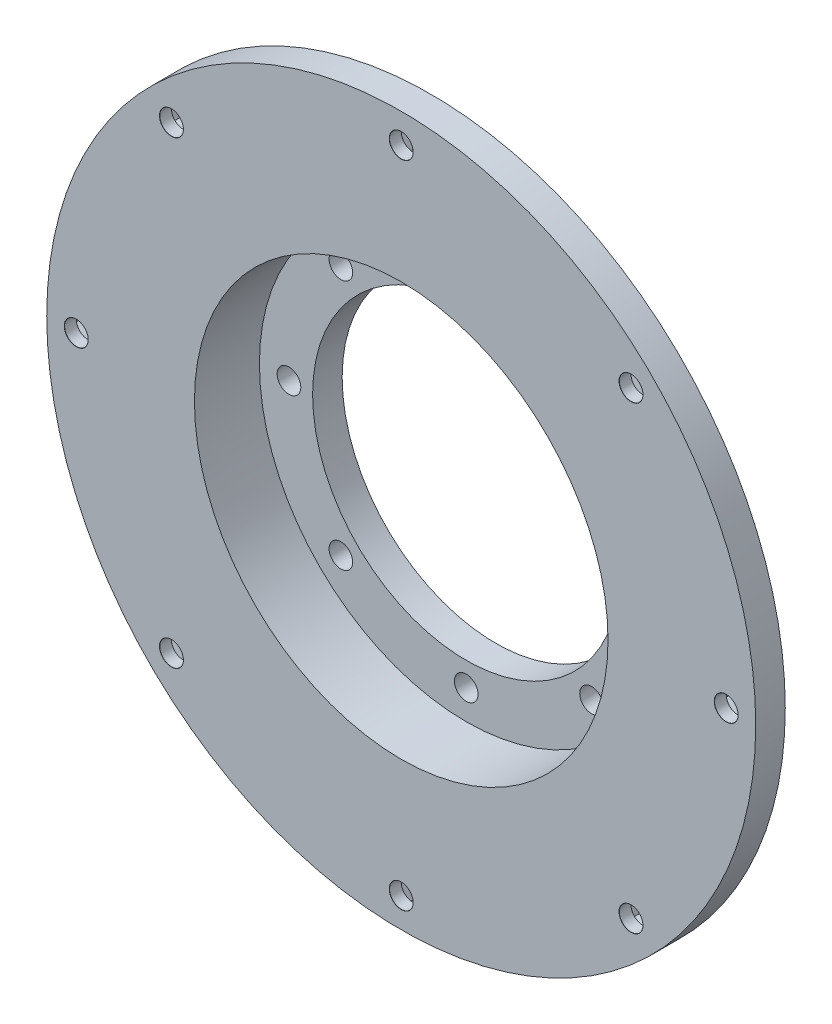
from build123d import *

# Parameters (mm, degrees)
SKETCH1_R                       = 35
SKETCH1_R_2                     = 26
BOSS_EXTRUDE1_DEPTH             = 5
F_4_0MM_DOWEL_HOLE1_D           = 4
F_4_0MM_DOWEL_HOLE1_CSINK_D     = 4.05
F_4_0MM_DOWEL_HOLE1_CSINK_ANGLE = 90
SKETCH5_R                       = 40
SKETCH5_R_2                     = 35
BOSS_EXTRUDE2_DEPTH             = 16
BOSS_EXTRUDE3_START             = -5
SKETCH6_R                       = 60
SKETCH6_R_2                     = 35
BOSS_EXTRUDE3_DEPTH             = 5
F_4_0MM_DOWEL_HOLE2_D           = 4
F_4_0MM_DOWEL_HOLE2_CSINK_D     = 4.05
F_4_0MM_DOWEL_HOLE2_CSINK_ANGLE = 90
CUT_EXTRUDE3_DEPTH              = 3


with BuildPart() as part:
    # Sketch1 → Boss-Extrude1 (new body)
    with BuildSketch(Plane.XY):
        Circle(SKETCH1_R)
        Circle(SKETCH1_R_2, mode=Mode.SUBTRACT)
    extrude(amount=BOSS_EXTRUDE1_DEPTH)

    # Ø4.0mm Dowel Hole1 (through all)
    with Locations(Plane(origin=(0, 0, 0), x_dir=(-1, 0, 0), z_dir=(0, 0, -1))):
        with Locations((21.213203436, 21.213203436), (0, 30), (-21.213203436, 21.213203436), (-30, 0), (-21.213203436, -21.213203436), (0, -30), (21.213203436, -21.213203436), (30, 0)):
            CounterSinkHole(F_4_0MM_DOWEL_HOLE1_D / 2, F_4_0MM_DOWEL_HOLE1_CSINK_D / 2, counter_sink_angle=F_4_0MM_DOWEL_HOLE1_CSINK_ANGLE)

    # Sketch5 → Boss-Extrude2 (add)
    with BuildSketch(Plane(origin=(0, 0, 0), x_dir=(-1, 0, 0), z_dir=(0, 0, -1))):
        Circle(SKETCH5_R)
        Circle(SKETCH5_R_2, mode=Mode.SUBTRACT)
    extrude(amount=-BOSS_EXTRUDE2_DEPTH)

    # Sketch6 → Boss-Extrude3 (add)
    with BuildSketch(Plane.XY.offset(16).offset(BOSS_EXTRUDE3_START)):
        Circle(SKETCH6_R)
        with Locations(Location((0, 0, 0), (0, 0, 180))):
            Circle(SKETCH6_R_2, mode=Mode.SUBTRACT)
    extrude(amount=BOSS_EXTRUDE3_DEPTH)

    # Ø4.0mm Dowel Hole2 (through all)
    with Locations(Plane.XY.offset(16)):
        with Locations((0, 55), (-38.890872965, 38.890872965), (-55, 0), (-38.890872965, -38.890872965), (0, -55), (38.890872965, -38.890872965), (55, 0), (38.890872965, 38.890872965)):
            CounterSinkHole(F_4_0MM_DOWEL_HOLE2_D / 2, F_4_0MM_DOWEL_HOLE2_CSINK_D / 2, counter_sink_angle=F_4_0MM_DOWEL_HOLE2_CSINK_ANGLE)

    # Sketch11 → Cut-Extrude3 (cut)
    with BuildSketch(Plane(origin=(0, 0, 11), x_dir=(-1, 0, 0), z_dir=(0, 0, -1))):
        Polygon((-37.755210701, 34.652523693), (-34.652523693, 37.755210701), (-35.788185958, 41.993559973), (-40.02653523, 43.129222238), (-43.129222238, 40.02653523), (-41.993559973, 35.788185958), align=None)
        Polygon((-2.193931023, 51.2), (2.193931023, 51.2), (4.387862046, 55), (2.193931023, 58.8), (-2.193931023, 58.8), (-4.387862046, 55), align=None)
        Polygon((34.652523693, 37.755210701), (37.755210701, 34.652523693), (41.993559973, 35.788185958), (43.129222238, 40.02653523), (40.02653523, 43.129222238), (35.788185958, 41.993559973), align=None)
        Polygon((-51.2, -2.193931023), (-51.2, 2.193931023), (-55, 4.387862046), (-58.8, 2.193931023), (-58.8, -2.193931023), (-55, -4.387862046), align=None)
        Polygon((51.2, 2.193931023), (51.2, -2.193931023), (55, -4.387862046), (58.8, -2.193931023), (58.8, 2.193931023), (55, 4.387862046), align=None)
        Polygon((37.755210701, -34.652523693), (34.652523693, -37.755210701), (35.788185958, -41.993559973), (40.02653523, -43.129222238), (43.129222238, -40.02653523), (41.993559973, -35.788185958), align=None)
        Polygon((2.193931023, -51.2), (-2.193931023, -51.2), (-4.387862046, -55), (-2.193931023, -58.8), (2.193931023, -58.8), (4.387862046, -55), align=None)
        Polygon((-34.652523693, -37.755210701), (-37.755210701, -34.652523693), (-41.993559973, -35.788185958), (-43.129222238, -40.02653523), (-40.02653523, -43.129222238), (-35.788185958, -41.993559973), align=None)
    extrude(amount=-CUT_EXTRUDE3_DEPTH, mode=Mode.SUBTRACT)


solid = part.part
